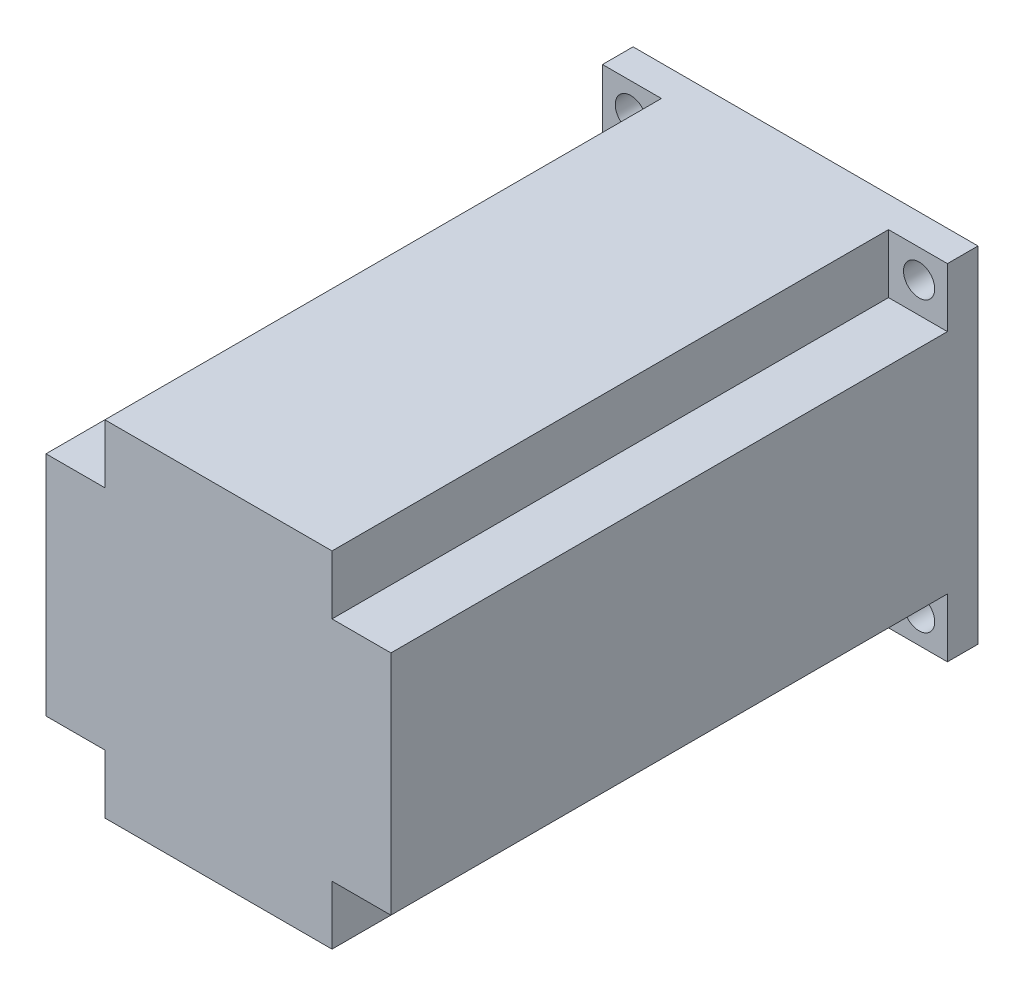
from build123d import *

# Parameters (mm, degrees)
SKETCH_1_W          = 56.4
SKETCH_1_H          = 56.4
SKETCH_1_R          = 2.55
EXTRUDE_1_DEPTH     = 96
CUT_EXTRUDE_START   = -91
SKETCH_2_W          = 9.63
SKETCH_2_H          = 9.63
SKETCH_2_R          = 2.55
SKETCH_2_W_2        = 10
SKETCH_2_H_2        = 10
CUT_EXTRUDE_1_DEPTH = 91
SKETCH_3_R          = 4
EXTRUDE_2_DEPTH     = 21
SKETCH_4_R          = 19.05
EXTRUDE_3_DEPTH     = 1.6


with BuildPart() as part:
    # 草图1 → 凸台-拉伸1 (new body)
    with BuildSketch(Plane.XY):
        Rectangle(SKETCH_1_W, SKETCH_1_H)
        with Locations((23.57, 23.57)):
            Circle(SKETCH_1_R, mode=Mode.SUBTRACT)
        with Locations((23.57, -23.57)):
            Circle(SKETCH_1_R, mode=Mode.SUBTRACT)
        with Locations((-23.57, -23.57)):
            Circle(SKETCH_1_R, mode=Mode.SUBTRACT)
        with Locations((-23.57, 23.57)):
            Circle(SKETCH_1_R, mode=Mode.SUBTRACT)
    extrude(amount=EXTRUDE_1_DEPTH)

    # 草图2 → 切除-拉伸1 (cut)
    # profile 1 of 4: a face of its own
    with BuildSketch(Plane.XY.offset(96).offset(CUT_EXTRUDE_START)):
        with Locations((-23.385, -23.385)):
            Rectangle(SKETCH_2_W, SKETCH_2_H)
        with Locations((-23.57, -23.57)):
            Circle(SKETCH_2_R, mode=Mode.SUBTRACT)
    # profile 2 of 4: a face of its own
    with BuildSketch(Plane.XY.offset(96).offset(CUT_EXTRUDE_START)):
        with Locations((23.385, -23.385)):
            Rectangle(SKETCH_2_W, SKETCH_2_H)
        with Locations((23.57, -23.57)):
            Circle(SKETCH_2_R, mode=Mode.SUBTRACT)
    # profile 3 of 4: a face of its own
    with BuildSketch(Plane.XY.offset(96).offset(CUT_EXTRUDE_START)):
        with Locations((23.385, 23.385)):
            Rectangle(SKETCH_2_W, SKETCH_2_H)
        with Locations((23.57, 23.57)):
            Circle(SKETCH_2_R, mode=Mode.SUBTRACT)
    # profile 4 of 4: a face of its own
    with BuildSketch(Plane.XY.offset(96).offset(CUT_EXTRUDE_START)):
        with Locations((-23.57, 23.57)):
            Rectangle(SKETCH_2_W_2, SKETCH_2_H_2)
    extrude(amount=CUT_EXTRUDE_1_DEPTH, mode=Mode.SUBTRACT)

    # 草图3 → 凸台-拉伸2 (add)
    with BuildSketch(Plane(origin=(0, 0, 0), x_dir=(-1, 0, 0), z_dir=(0, 0, -1))):
        with Locations(Location((0, 0, 0), (0, 0, 180))):
            Circle(SKETCH_3_R)
    extrude(amount=EXTRUDE_2_DEPTH)

    # 草图4 → 凸台-拉伸3 (add)
    with BuildSketch(Plane(origin=(0, 0, 0), x_dir=(-1, 0, 0), z_dir=(0, 0, -1))):
        with Locations(Location((0, 0, 0), (0, 0, 180))):
            Circle(SKETCH_4_R)
    extrude(amount=EXTRUDE_3_DEPTH)


solid = part.part
